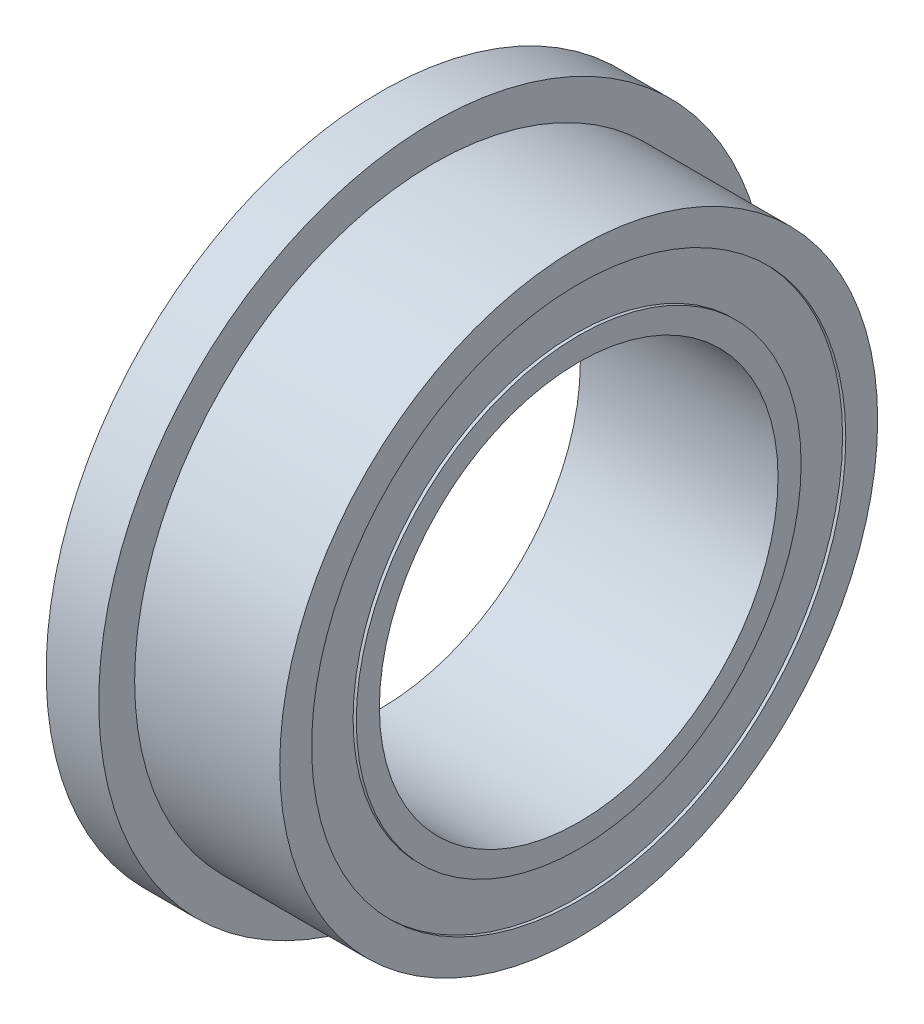
from build123d import *

# Parameters (mm, degrees)
SKETCH1_R           = 5.334
BOSS_EXTRUDE1_DEPTH = 0.8382
SKETCH2_R           = 4.7625
BOSS_EXTRUDE2_DEPTH = 2.3114
SKETCH3_R           = 3.175
CUT_EXTRUDE1_DEPTH  = 9.174539263
SKETCH4_R           = 4.4069
SKETCH4_R_2         = 3.5433
CUT_EXTRUDE2_DEPTH  = 0.0508
CUT_EXTRUDE3_START  = -0.0508
SKETCH5_R           = 4.2545
SKETCH5_R_2         = 3.5433
CUT_EXTRUDE3_DEPTH  = 0.0508


with BuildPart() as part:
    # Sketch1 → Boss-Extrude1 (new body)
    with BuildSketch(Plane(origin=(0, 0, 0), x_dir=(0, 0, -1), z_dir=(1, 0, 0))):
        Circle(SKETCH1_R)
    extrude(amount=BOSS_EXTRUDE1_DEPTH)

    # Sketch2 → Boss-Extrude2 (add)
    with BuildSketch(Plane(origin=(0.8382, 0, 0), x_dir=(0, 0, -1), z_dir=(1, 0, 0))):
        Circle(SKETCH2_R)
    extrude(amount=BOSS_EXTRUDE2_DEPTH)

    # Sketch3 → Cut-Extrude1 (cut, through all)
    with BuildSketch(Plane(origin=(3.1496, 0, 0), x_dir=(0, 0, -1), z_dir=(1, 0, 0))):
        Circle(SKETCH3_R)
    extrude(amount=-CUT_EXTRUDE1_DEPTH, mode=Mode.SUBTRACT)

    # Sketch4 → Cut-Extrude2 (cut)
    with BuildSketch(Plane.ZY):
        Circle(SKETCH4_R)
        Circle(SKETCH4_R_2, mode=Mode.SUBTRACT)
    extrude(amount=-CUT_EXTRUDE2_DEPTH, mode=Mode.SUBTRACT)

    # Sketch5 → Cut-Extrude3 (cut)
    with BuildSketch(Plane(origin=(3.1496, 0, 0), x_dir=(0, 0, -1), z_dir=(1, 0, 0)).offset(CUT_EXTRUDE3_START)):
        Circle(SKETCH5_R)
        with Locations(Location((0, 0, 0), (0, 0, 180))):
            Circle(SKETCH5_R_2, mode=Mode.SUBTRACT)
    extrude(amount=CUT_EXTRUDE3_DEPTH, mode=Mode.SUBTRACT)


solid = part.part
